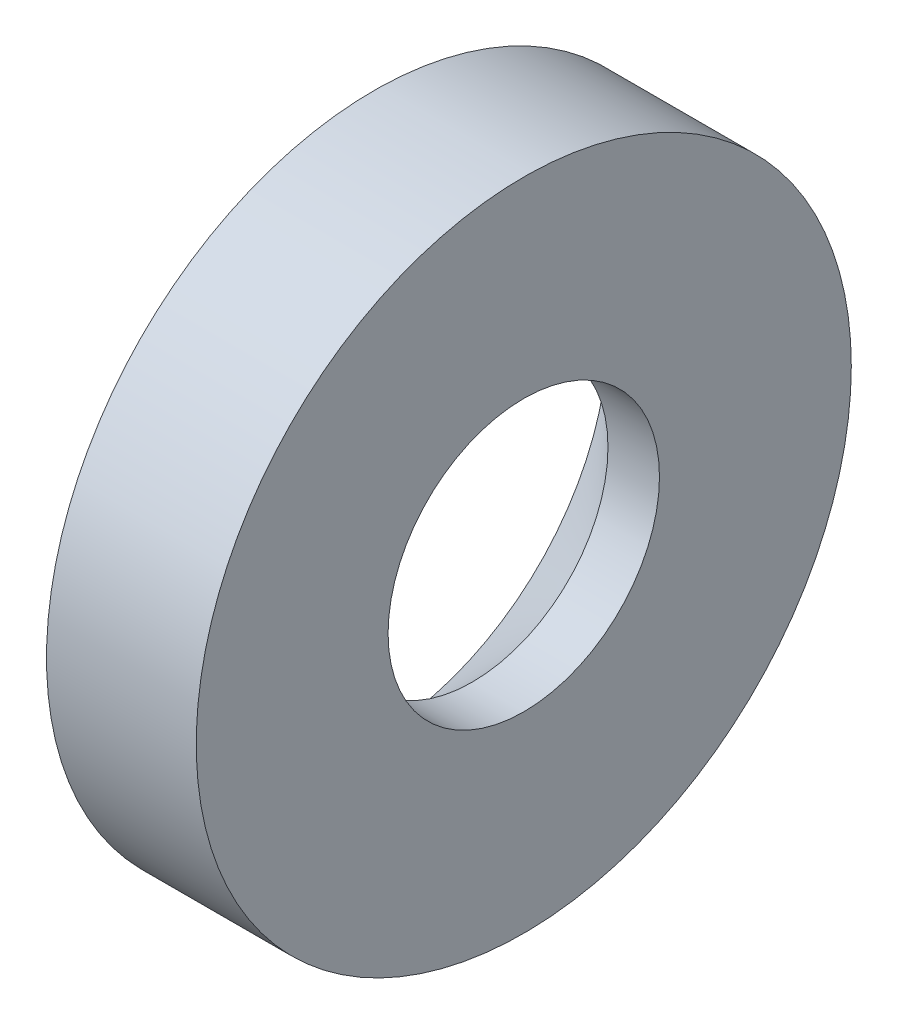
from build123d import *

# Parameters (mm, degrees)
SKETCH1_R                      = 17.5
BOSS_EXTRUDE1_DEPTH            = 4
CSK_FOR_M20_SFHCS1_D           = 14.5
CSK_FOR_M20_SFHCS1_DEPTH       = 30.643760512
CSK_FOR_M20_SFHCS1_CSINK_D     = 25
CSK_FOR_M20_SFHCS1_CSINK_ANGLE = 90
CSK_FOR_M20_SFHCS1_TIP         = 4.356239488


with BuildPart() as part:
    # Sketch1 → Boss-Extrude1 (new, symmetric)
    with BuildSketch(Plane(origin=(0, 0, 0), x_dir=(0, 0, -1), z_dir=(1, 0, 0))):
        Circle(SKETCH1_R)
    extrude(amount=BOSS_EXTRUDE1_DEPTH, both=True)

    # CSK for M20 SFHCS1
    with Locations(Plane.ZY.offset(4)):
        with Locations((0, 0)):
            CounterSinkHole(CSK_FOR_M20_SFHCS1_D / 2, CSK_FOR_M20_SFHCS1_CSINK_D / 2, depth=CSK_FOR_M20_SFHCS1_DEPTH, counter_sink_angle=CSK_FOR_M20_SFHCS1_CSINK_ANGLE)
            with Locations((0, 0, -(CSK_FOR_M20_SFHCS1_DEPTH + CSK_FOR_M20_SFHCS1_TIP / 2))):  # 118° drill point
                Cone(0, CSK_FOR_M20_SFHCS1_D / 2, CSK_FOR_M20_SFHCS1_TIP, mode=Mode.SUBTRACT)


solid = part.part
